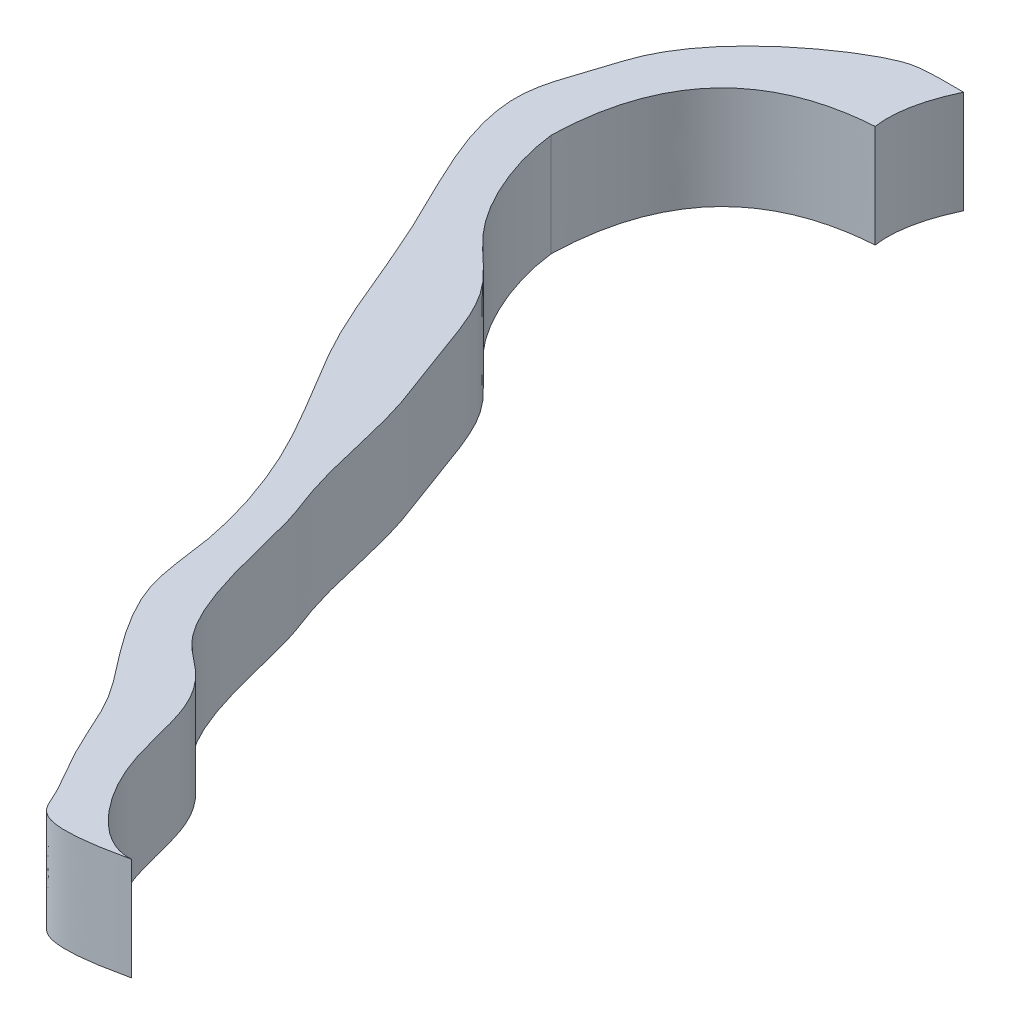
from build123d import *

# Parameters (mm, degrees)
BOSS_EXTRUDE1_DEPTH = 15


with BuildPart() as part:
    # Sketch1 → Boss-Extrude1 (new body)
    with BuildSketch(Plane(origin=(0, 0, 0), x_dir=(1, 0, 0), z_dir=(0, 1, 0))):
        with BuildLine():
            add(Edge.make_bspline(
                [(46.571971646, 170.254393187), (46.243867759, 172.500755861), (46.481266328, 175.052116123), (47.445167588, 177.95175501)],
                knots=[0.884490366, 0.884490366, 0.884490366, 0.884490366, 0.970702095, 0.970702095, 0.970702095, 0.970702095], degree=3))
            add(Edge.make_bspline(
                [(47.445167588, 177.95175501), (47.772736564, 178.937158577), (48.184208573, 179.962784477), (48.685902451, 181.030331376)],
                knots=[0.970702095, 0.970702095, 0.970702095, 0.970702095, 1, 1, 1, 1], degree=3))
            add(Edge.make_bspline(
                [(84.954156509, 23.374845148), (72.957531209, 20.674507359), (71.967420274, 25.36061498), (66.970310861, 32.726356759), (63.463279278, 41.939494185), (58.212219063, 48.04090818), (50.9967727, 58.556105774), (50.55603225, 70.290611927), (44.900897129, 87.417453936), (33.109231862, 103.911358313), (26.397601002, 123.949892357), (14.065710158, 144.879655619), (18.692253578, 155.824640569), (22.359924523, 168.973403316), (39.240148531, 181.236738913), (43.121346445, 181.068143657), (48.685902451, 181.030331376)],
                knots=[0, 0, 0, 0, 0.044480101, 0.090012582, 0.138443027, 0.188153337, 0.244035911, 0.30020894, 0.39094818, 0.496437396, 0.613722098, 0.738952285, 0.786997961, 0.806175267, 0.930725345, 1, 1, 1, 1], degree=3))
            add(Edge.make_bspline(
                [(24.037514039, 145.517039337), (24.262193341, 143.639002283), (25.417126955, 138.13476126), (30.007706349, 128.357618332), (39.799149221, 121.115164184), (43.212879708, 110.146291015), (48.655011635, 97.057373026), (49.967287218, 86.727943744), (54.645986215, 75.411140051), (57.593504204, 57.548820676), (72.352035983, 47.851599968), (69.140361711, 35.824975137), (81.048923957, 23.103025259), (84.954156509, 23.374845148)],
                knots=[0.084882791, 0.084882791, 0.084882791, 0.084882791, 0.107769948, 0.154078141, 0.187829052, 0.232552433, 0.269709292, 0.335228905, 0.347596967, 0.388301803, 0.400297277, 0.462463604, 0.490432201, 0.490432201, 0.490432201, 0.490432201], degree=3))
            add(Edge.make_bspline(
                [(24.037514039, 145.517039337), (24.615355603, 168.822282886), (46.571971646, 170.254393187)],
                knots=[0, 0, 0, 1, 1, 1], degree=2))
        make_face()
    extrude(amount=BOSS_EXTRUDE1_DEPTH)


solid = part.part
